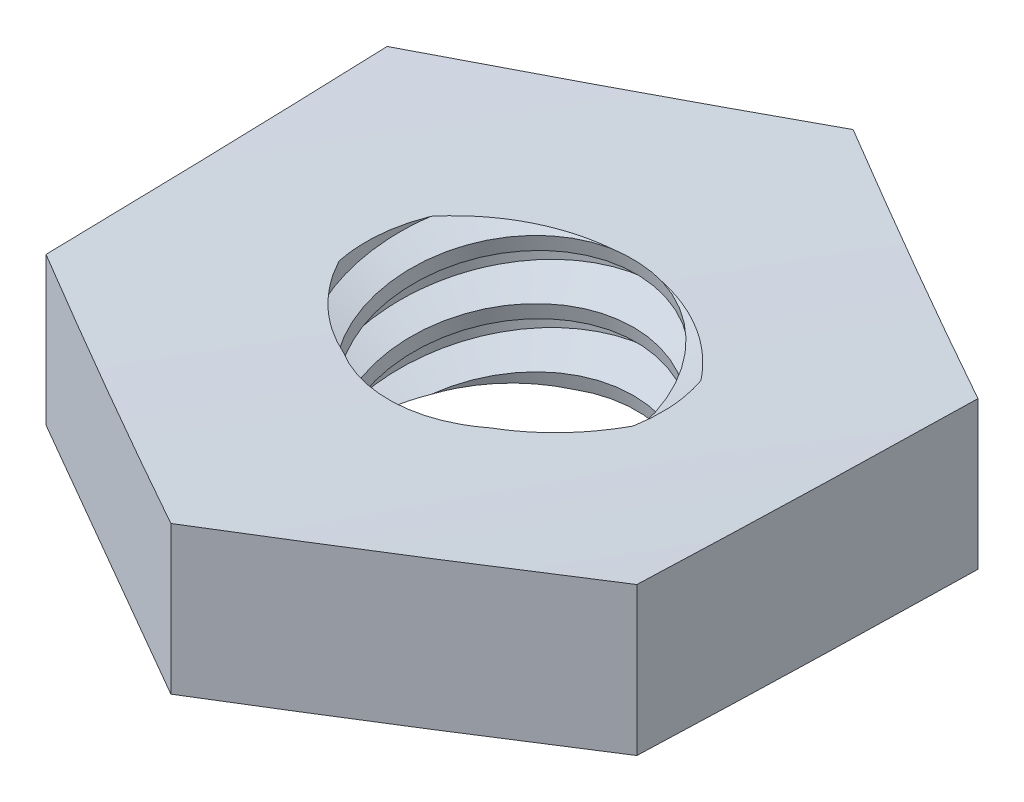
from build123d import *

# Parameters (mm, degrees)
EXTRUDE1_DEPTH      = 0.8
SKETCH2_W           = 1
SKETCH2_H           = 1.6
LPATTERN1_COUNT     = 4
LPATTERN1_PITCH     = 0.4
LPATTERN1_COL_COUNT = 2
LPATTERN1_COL_PITCH = 0.4
CUT_EXTRUDE1_DEPTH  = 10


with BuildPart() as part:
    # Sketch1 → Extrude1 (new, symmetric)
    with BuildSketch(Plane(origin=(0, 0, 0), x_dir=(1, 0, 0), z_dir=(0, 1, 0))):
        Polygon((0, 2.309401077), (-2, 1.154700538), (-2, -1.154700538), (0, -2.309401077), (2, -1.154700538), (2, 1.154700538), align=None)
    extrude(amount=EXTRUDE1_DEPTH, both=True)

    # Sketch4 → Cut-Revolve2 (revolve, cut)
    with BuildSketch(Plane(origin=(0, 0, 0), x_dir=(0, 0, -1), z_dir=(1, 0, 0))):
        Polygon((0, 0.8), (1, 0.8), (0.82201838, 0.717005807), (0.82201838, -0.717005807), (1, -0.8), (0, -0.8), align=None)
    revolve(axis=Axis((0, 0.8, 0), (0, 1, 0)), mode=Mode.SUBTRACT)


with BuildPart() as body_2:
    # Sketch2 → Revolve1 (revolve)
    with BuildSketch(Plane(origin=(0, 0, 0), x_dir=(0, 0, -1), z_dir=(1, 0, 0))):
        with Locations((0.5, 0)):
            Rectangle(SKETCH2_W, SKETCH2_H)
    revolve(axis=Axis((0, -1.8, 0), (0, 1, 0)))

    # Sketch3 → Cut-Revolve1 (revolve, cut)
    with BuildSketch(Plane(origin=(0, 0, 0), x_dir=(0, 0, -1), z_dir=(1, 0, 0)), mode=Mode.PRIVATE) as cut_revolve1_sk:
        Polygon((1.009805807, 0.750970966), (1.078446454, 0.40776773), (0.841629993, 0.487879925), (0.82201838, 0.585937993), align=None)
    cut_revolve1 = revolve(cut_revolve1_sk.sketch.rotate(Axis((0, 0.8, 0.085891176), (0, -0.9805806756909201, -0.19611613513818416)), 180), axis=Axis((0, 0.8, 0.085891176), (0, -0.9805806756909201, -0.19611613513818416)), mode=Mode.SUBTRACT)

    # LPattern1: Cut-Revolve1 ×4
    with Locations(*[(0, -i * LPATTERN1_PITCH, 0) for i in range(1, LPATTERN1_COUNT)]):
        add(cut_revolve1, mode=Mode.SUBTRACT)

    # LPattern1 col: Cut-Revolve1 ×2
    with Locations(*[(0, i * LPATTERN1_COL_PITCH, 0) for i in range(1, LPATTERN1_COL_COUNT)]):
        add(cut_revolve1, mode=Mode.SUBTRACT)


with BuildPart() as part_1:
    add(part.part)

    # Combine1: cut body 2
    add(body_2.part, mode=Mode.SUBTRACT)

    # Sketch6 → Cut-Extrude1 (cut)
    with BuildSketch(Plane(origin=(-1, 0, 1.732050808), x_dir=(0.8660254037844386, 0, 0.5), z_dir=(-0.5000000000000001, 0, 0.8660254037844387))):
        with BuildLine():
            ThreePointArc((-9.048253748, 1.529048513), (0, 0.179159881), (9.048253748, 1.529048513))
            add(Edge.make_bspline(
                [(9.048253748, 1.529048513), (0.30516196, 6.548590319), (-9.048253748, 1.529048513)],
                knots=[0, 0, 0, 1, 1, 1], degree=2))
        make_face()
        with BuildLine():
            ThreePointArc((-9.370997107, 0.58202908), (0, -0.820840119), (9.370997107, 0.58202908))
            add(Edge.make_bspline(
                [(-9.370997107, 0.58202908), (0.133381253, -6.42773587), (9.370997107, 0.58202908)],
                knots=[0, 0, 0, 1, 1, 1], degree=2))
        make_face()
    extrude(amount=-CUT_EXTRUDE1_DEPTH, mode=Mode.SUBTRACT)


solid = part_1.part
